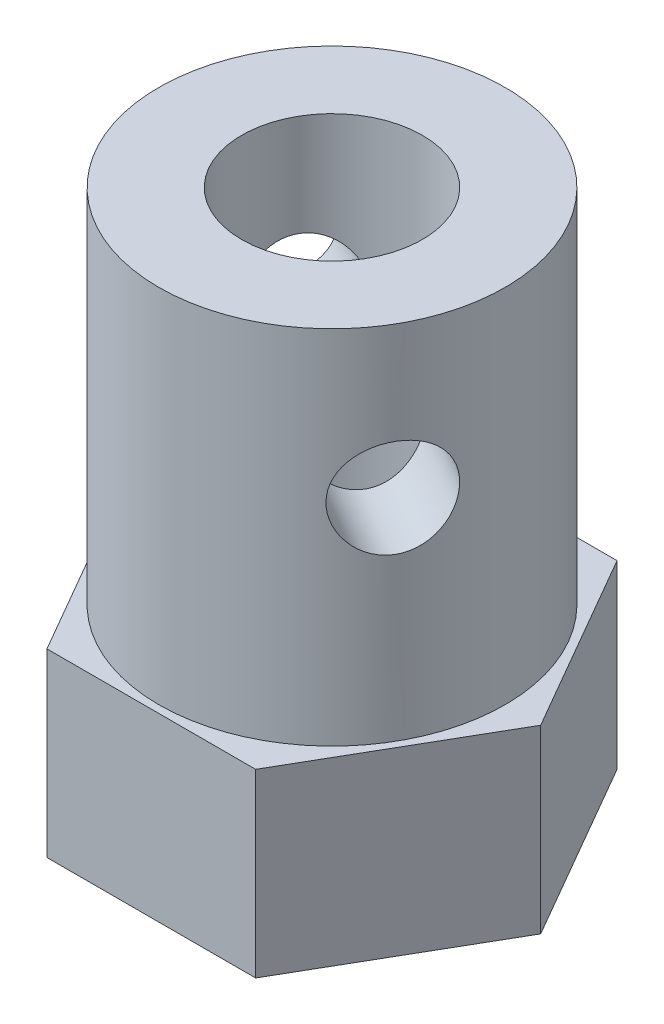
from build123d import *

# Parameters (mm, degrees)
EXTRUDE_1_DEPTH     = 6
SKETCH_2_R          = 5.75
EXTRUDE_2_DEPTH     = 12
SKETCH_3_R          = 1.625
CUT_EXTRUDE_1_DEPTH = 300
SKETCH_4_R          = 3
CUT_EXTRUDE_2_DEPTH = 12
SKETCH_5_R          = 1.625
CUT_EXTRUDE_3_DEPTH = 12


with BuildPart() as part:
    # Эскиз1 → Бобышка-Вытянуть1 (new body)
    with BuildSketch(Plane(origin=(0, 0, 0), x_dir=(1, 0, 0), z_dir=(0, 1, 0))):
        Polygon((6.92820323, 0), (3.464101615, 6), (-3.464101615, 6), (-6.92820323, 0), (-3.464101615, -6), (3.464101615, -6), align=None)
    extrude(amount=EXTRUDE_1_DEPTH)

    # Эскиз2 → Бобышка-Вытянуть2 (add)
    with BuildSketch(Plane(origin=(0, 6, 0), x_dir=(1, 0, 0), z_dir=(0, 1, 0))):
        with Locations(Location((0, 0, 0), (0, 0, 270))):
            Circle(SKETCH_2_R)
    extrude(amount=EXTRUDE_2_DEPTH)

    # Эскиз3 → Вырез-Вытянуть1 (cut)
    with BuildSketch(Plane.XZ):
        with Locations(Location((0, 0, 0), (0, 0, 270))):
            Circle(SKETCH_3_R)
    extrude(amount=-CUT_EXTRUDE_1_DEPTH, mode=Mode.SUBTRACT)

    # Эскиз4 → Вырез-Вытянуть2 (cut)
    with BuildSketch(Plane(origin=(0, 18, 0), x_dir=(1, 0, 0), z_dir=(0, 1, 0))):
        with Locations(Location((0, 0, 0), (0, 0, 270))):
            Circle(SKETCH_4_R)
    extrude(amount=-CUT_EXTRUDE_2_DEPTH, mode=Mode.SUBTRACT)

    # Эскиз5 → Вырез-Вытянуть3 (cut)
    with BuildSketch(Plane(origin=(-5.196152423, 0, -3), x_dir=(-0.5000000000000003, 0, 0.8660254037844386), z_dir=(-0.8660254037844385, 0, -0.5000000000000002))):
        with Locations((0, 13)):
            Circle(SKETCH_5_R)
    extrude(amount=-CUT_EXTRUDE_3_DEPTH, mode=Mode.SUBTRACT)


solid = part.part
